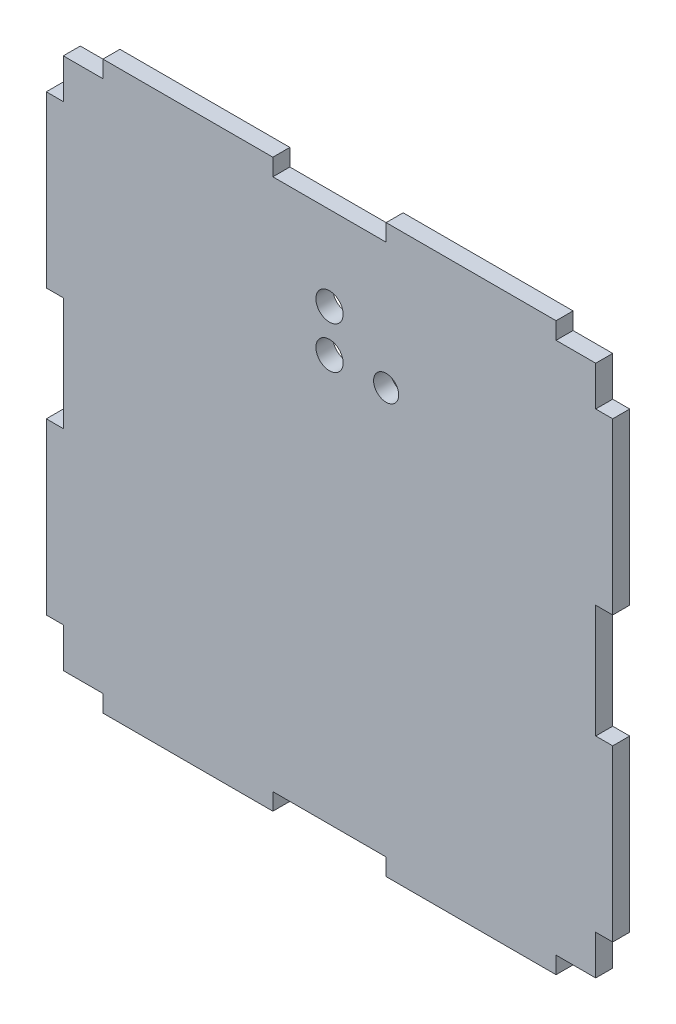
from build123d import *

# Parameters (mm, degrees)
ESQUISSE1_R        = 2.403126526
ESQUISSE1_R_2      = 2.216438954
BOSS_EXTRU_1_DEPTH = 3


with BuildPart() as part:
    # Esquisse1 → Boss.-Extru.1 (new body)
    with BuildSketch(Plane.XY):
        Polygon((19.258166425, 80.200130208), (-10.741833575, 80.200130208), (-10.741833575, 77.200130208), (-30.741833575, 77.200130208), (-30.741833575, 80.200130208), (-60.741833575, 80.200130208), (-60.741833575, 77.200130208), (-67.741833575, 77.200130208), (-67.741833575, 70.200130208), (-70.741833575, 70.200130208), (-70.741833575, 40.200130208), (-67.741833575, 40.200130208), (-67.741833575, 20.200130208), (-70.741833575, 20.200130208), (-70.741833575, -9.799869792), (-67.741833575, -9.799869792), (-67.741833575, -16.799869792), (-60.741833575, -16.799869792), (-60.741833575, -19.799869792), (-30.741833575, -19.799869792), (-30.741833575, -16.799869792), (-10.741833575, -16.799869792), (-10.741833575, -19.799869792), (19.258166425, -19.799869792), (19.258166425, -16.799869792), (26.258166425, -16.799869792), (26.258166425, -9.799869792), (29.258166425, -9.799869792), (29.258166425, 20.200130208), (26.258166425, 20.200130208), (26.258166425, 40.200130208), (29.258166425, 40.200130208), (29.258166425, 70.200130208), (26.258166425, 70.200130208), (26.258166425, 77.200130208), (19.258166425, 77.200130208), align=None)
        with Locations((-20.741833575, 54.939895236)):
            Circle(ESQUISSE1_R, mode=Mode.SUBTRACT)
        with Locations((-20.741833575, 62.376344524)):
            Circle(ESQUISSE1_R, mode=Mode.SUBTRACT)
        with Locations((-10.741833575, 54.939895236)):
            Circle(ESQUISSE1_R_2, mode=Mode.SUBTRACT)
    extrude(amount=BOSS_EXTRU_1_DEPTH)


solid = part.part
